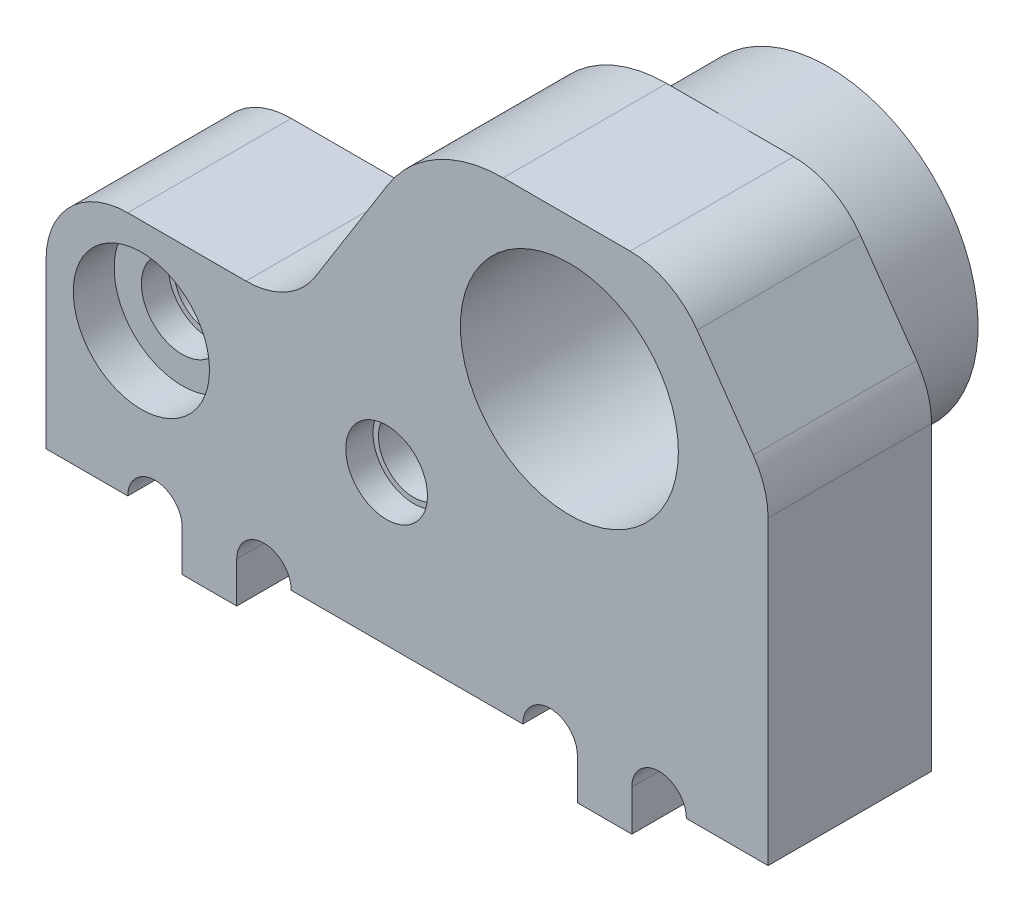
from build123d import *

# Parameters (mm, degrees)
SKETCH1_W           = 26.5
SKETCH1_H           = 6
BOSS_EXTRUDE1_DEPTH = 17
SKETCH2_R           = 1.5
CUT_EXTRUDE1_DEPTH  = 1
SKETCH3_R           = 1.3
CUT_EXTRUDE2_DEPTH  = 32.878676259
SKETCH4_R           = 4
CUT_EXTRUDE3_DEPTH  = 33.050741021
SKETCH5_R           = 2.5
CUT_EXTRUDE4_DEPTH  = 1.5
SKETCH6_R           = 1.5
CUT_EXTRUDE8_DEPTH  = 1
SKETCH7_R           = 1.3
CUT_EXTRUDE9_DEPTH  = 32.678068123
CUT_EXTRUDE10_START = -1
SKETCH8_R           = 2.5
CUT_EXTRUDE10_DEPTH = 1
CUT_EXTRUDE11_START = -1
SKETCH9_R           = 1.5
CUT_EXTRUDE11_DEPTH = 1
SKETCH10_R          = 5.5
SKETCH10_R_2        = 4
BOSS_EXTRUDE2_DEPTH = 3.5
SKETCH11_R          = 3
SKETCH11_R_2        = 1.3
BOSS_EXTRUDE4_DEPTH = 2
CUT_EXTRUDE12_START = -1
SKETCH12_R          = 1.5
CUT_EXTRUDE12_DEPTH = 1
SKETCH17_W          = 2
SKETCH17_H          = 6
BOSS_EXTRUDE6_DEPTH = 1.5
SKETCH18_R          = 1
CUT_EXTRUDE17_DEPTH = 33.050741021
CHAMFER2_SIZE       = 5
CHAMFER2_SIZE2      = 3.5
FILLET11_R          = 3
BOSS_EXTRUDE7_DEPTH = 2
CUT_EXTRUDE19_DEPTH = 33.050741021
FILLET13_R          = 5
FILLET14_R          = 3
FILLET15_R          = 3


with BuildPart() as part:
    # Sketch1 → Boss-Extrude1 (new body)
    with BuildSketch(Plane(origin=(0, 0, 0), x_dir=(1, 0, 0), z_dir=(0, 1, 0))):
        with Locations((13.25, 3)):
            Rectangle(SKETCH1_W, SKETCH1_H)
    extrude(amount=BOSS_EXTRUDE1_DEPTH)

    # Sketch2 → Cut-Extrude1 (cut)
    with BuildSketch(Plane.XY):
        with Locations((12.5, 5.5)):
            Circle(SKETCH2_R)
    extrude(amount=-CUT_EXTRUDE1_DEPTH, mode=Mode.SUBTRACT)

    # Sketch3 → Cut-Extrude2 (cut, through all)
    with BuildSketch(Plane.XY.offset(-1)):
        with Locations((12.5, 5.5)):
            Circle(SKETCH3_R)
    extrude(amount=-CUT_EXTRUDE2_DEPTH, mode=Mode.SUBTRACT)

    # Sketch4 → Cut-Extrude3 (cut, through all)
    with BuildSketch(Plane.XY):
        with Locations((19.208203932, 11.5)):
            Circle(SKETCH4_R)
    extrude(amount=-CUT_EXTRUDE3_DEPTH, mode=Mode.SUBTRACT)

    # Sketch5 → Cut-Extrude4 (cut)
    with BuildSketch(Plane.XY):
        with Locations((3.5, 5.5)):
            Circle(SKETCH5_R)
    extrude(amount=-CUT_EXTRUDE4_DEPTH, mode=Mode.SUBTRACT)

    # Sketch6 → Cut-Extrude8 (cut)
    with BuildSketch(Plane.XY.offset(-1.5)):
        with Locations((3.5, 5.5)):
            Circle(SKETCH6_R)
    extrude(amount=-CUT_EXTRUDE8_DEPTH, mode=Mode.SUBTRACT)

    # Sketch7 → Cut-Extrude9 (cut, through all)
    with BuildSketch(Plane.XY.offset(-2.5)):
        with Locations((3.5, 5.5)):
            Circle(SKETCH7_R)
    extrude(amount=-CUT_EXTRUDE9_DEPTH, mode=Mode.SUBTRACT)

    # Sketch8 → Cut-Extrude10 (cut)
    with BuildSketch(Plane(origin=(0, 0, -6), x_dir=(-1, 0, 0), z_dir=(0, 0, -1)).offset(CUT_EXTRUDE10_START)):
        with Locations(Location((-3.5, 5.5, 0), (0, 0, 180))):
            Circle(SKETCH8_R)
    extrude(amount=CUT_EXTRUDE10_DEPTH, mode=Mode.SUBTRACT)

    # Sketch9 → Cut-Extrude11 (cut)
    with BuildSketch(Plane(origin=(0, 0, -5), x_dir=(-1, 0, 0), z_dir=(0, 0, -1)).offset(CUT_EXTRUDE11_START)):
        with Locations(Location((-3.5, 5.5, 0), (0, 0, 180))):
            Circle(SKETCH9_R)
    extrude(amount=CUT_EXTRUDE11_DEPTH, mode=Mode.SUBTRACT)

    # Sketch10 → Boss-Extrude2 (add)
    with BuildSketch(Plane(origin=(0, 0, -6), x_dir=(-1, 0, 0), z_dir=(0, 0, -1))):
        with Locations(Location((-19.208203932, 11.5, 0), (0, 0, 90))):
            Circle(SKETCH10_R)
        with Locations(Location((-19.208203932, 11.5, 0), (0, 0, 180))):
            Circle(SKETCH10_R_2, mode=Mode.SUBTRACT)
    extrude(amount=BOSS_EXTRUDE2_DEPTH)

    # Sketch11 → Boss-Extrude4 (add)
    with BuildSketch(Plane(origin=(0, 0, -6), x_dir=(-1, 0, 0), z_dir=(0, 0, -1))):
        with Locations(Location((-12.5, 5.5, 0), (0, 0, 180))):
            Circle(SKETCH11_R)
        with Locations(Location((-12.5, 5.5, 0), (0, 0, 180))):
            Circle(SKETCH11_R_2, mode=Mode.SUBTRACT)
    extrude(amount=BOSS_EXTRUDE4_DEPTH)

    # Sketch12 → Cut-Extrude12 (cut)
    with BuildSketch(Plane(origin=(0, 0, -8), x_dir=(-1, 0, 0), z_dir=(0, 0, -1)).offset(CUT_EXTRUDE12_START)):
        with Locations(Location((-12.5, 5.5, 0), (0, 0, 180))):
            Circle(SKETCH12_R)
    extrude(amount=CUT_EXTRUDE12_DEPTH, mode=Mode.SUBTRACT)

    # Sketch17 → Boss-Extrude6 (add)
    with BuildSketch(Plane.XZ):
        with Locations((6, -3)):
            Rectangle(SKETCH17_W, SKETCH17_H)
        with Locations((20.5, -3)):
            Rectangle(SKETCH17_W, SKETCH17_H)
    extrude(amount=BOSS_EXTRUDE6_DEPTH)

    # Sketch18 → Cut-Extrude17 (cut, through all)
    with BuildSketch(Plane(origin=(0, 0, -6), x_dir=(-1, 0, 0), z_dir=(0, 0, -1))):
        with Locations((-22.5, 0)):
            Circle(SKETCH18_R)
        with Locations((-18.5, 0)):
            Circle(SKETCH18_R)
        with Locations((-8, 0)):
            Circle(SKETCH18_R)
        with Locations((-4, 0)):
            Circle(SKETCH18_R)
    extrude(amount=-CUT_EXTRUDE17_DEPTH, mode=Mode.SUBTRACT)

    # Chamfer2
    chamfer2_edges = [part.edges().sort_by_distance(p)[0] for p in [
        (26.5, 17, -3),
    ]]
    chamfer2_side = [part.faces().sort_by_distance(p)[0] for p in [
        (26.5, 8.5, -3),
    ]]
    chamfer(chamfer2_edges, length=CHAMFER2_SIZE, length2=CHAMFER2_SIZE2, reference=chamfer2_side[0])

    # Fillet11
    fillet11_edges = [part.edges().sort_by_distance(p)[0] for p in [
        (23, 17, -3),
        (26.5, 12, -3),
    ]]
    fillet(fillet11_edges, radius=FILLET11_R)

    # Sketch19 → Boss-Extrude7 (add)
    with BuildSketch(Plane(origin=(0, 0, -6), x_dir=(-1, 0, 0), z_dir=(0, 0, -1))):
        with BuildLine():
            Line((-14.547099294, 14.419606745), (-9.957579288, 7.09251277))
            ThreePointArc((-9.957579288, 7.09251277), (-14.736067977, 7.5), (-13.800160725, 2.796376119))
            Line((-13.800160725, 2.796376119), (-21.591831928, 6.543356218))
            ThreePointArc((-21.591831928, 6.543356218), (-15.108745974, 7.833333333), (-14.547099294, 14.419606745))
        make_face()
    extrude(amount=BOSS_EXTRUDE7_DEPTH)

    # Sketch20 → Cut-Extrude19 (cut, through all)
    with BuildSketch(Plane(origin=(0, 0, -6), x_dir=(-1, 0, 0), z_dir=(0, 0, -1))):
        Polygon((0, 17), (-14.011012575, 17), (-9, 9), (0, 9), align=None)
    extrude(amount=-CUT_EXTRUDE19_DEPTH, mode=Mode.SUBTRACT)

    # Fillet13
    fillet13_edges = [part.edges().sort_by_distance(p)[0] for p in [
        (14.011012575, 17, -3),
    ]]
    fillet(fillet13_edges, radius=FILLET13_R)

    # Fillet14
    fillet14_edges = [part.edges().sort_by_distance(p)[0] for p in [
        (9, 9, -3),
    ]]
    fillet(fillet14_edges, radius=FILLET14_R)

    # Fillet15
    fillet15_edges = [part.edges().sort_by_distance(p)[0] for p in [
        (0, 9, -3),
    ]]
    fillet(fillet15_edges, radius=FILLET15_R)


solid = part.part
